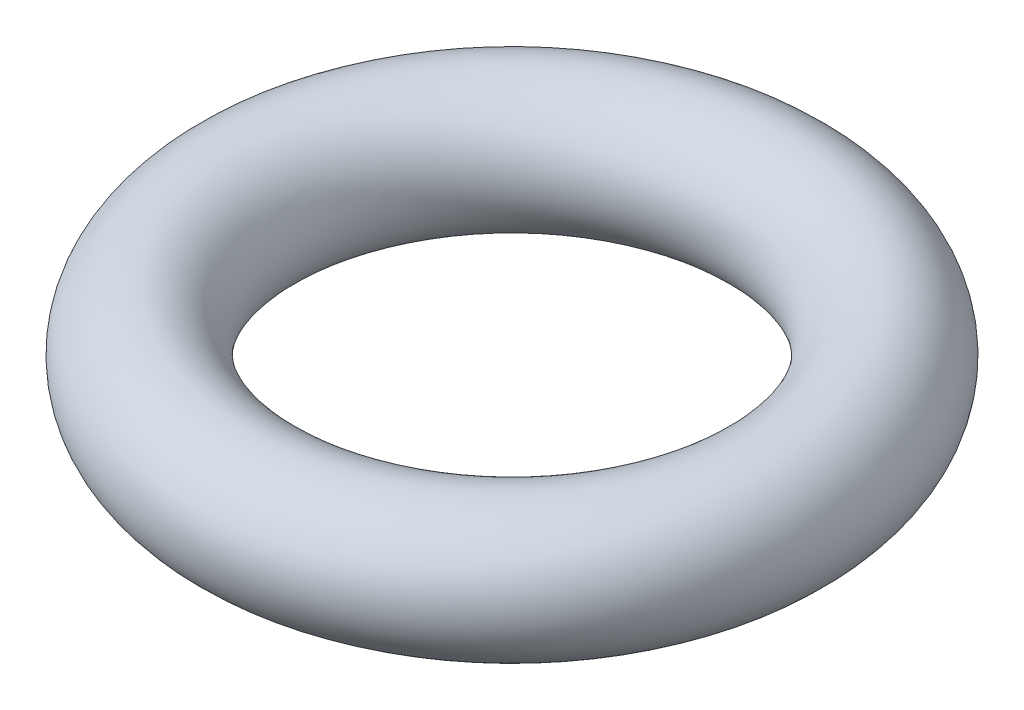
from build123d import *

# Parameters (mm, degrees)
SKETCH1_R = 12.7


with BuildPart() as part:
    # Sketch1 → Revolve1 (revolve)
    with BuildSketch(Plane.XY, mode=Mode.PRIVATE) as revolve1_sk:
        with Locations((50.8, 12.7)):
            Circle(SKETCH1_R)
    revolve(revolve1_sk.sketch.rotate(Axis((0, 0, 0), (0, 1, 0)), 90), axis=Axis((0, 0, 0), (0, 1, 0)))


solid = part.part
